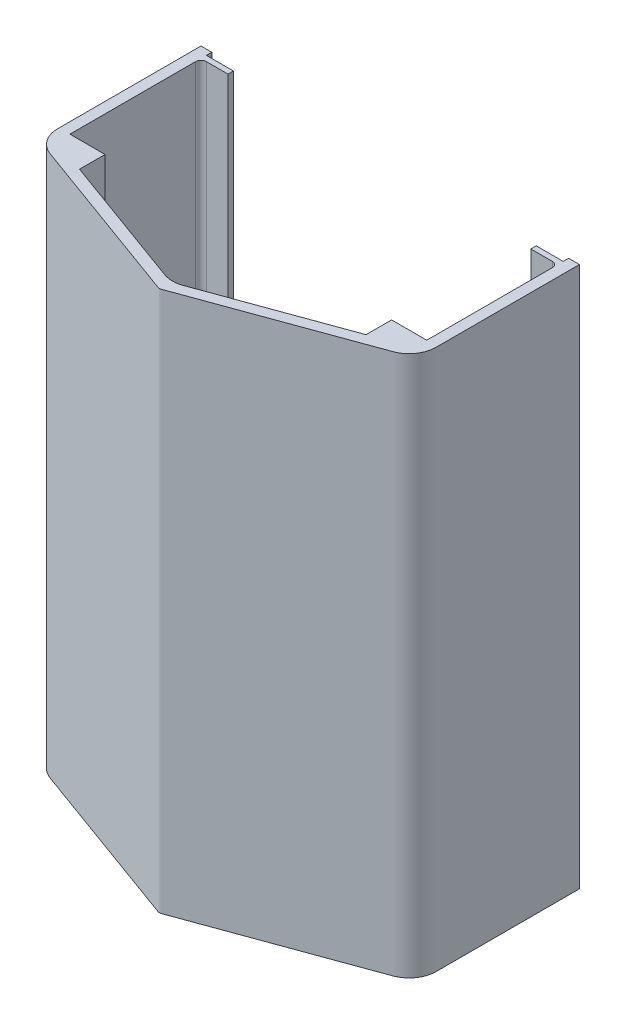
from build123d import *

# Parameters (mm, degrees)
SHELL1_T            = -4
FILLET1_R           = 10
BOSS_EXTRUDE4_DEPTH = 200
CUT_EXTRUDE1_DEPTH  = 200
FILLET3_R           = 2


with BuildPart() as part:
    # Sketch3 for Loft1 → Loft1 section 0
    with BuildSketch(Plane(origin=(0, 200, 0), x_dir=(1, 0, 0), z_dir=(0, 1, 0))):
        with BuildLine():
            Line((-91.643479102, 47.875432933), (48.356520898, 47.875432933))
            Line((48.356520898, 47.875432933), (48.356520898, -5.122491685))
            # circular arc as an exact rational Bezier (weights 1, cos(half-angle), 1)
            Bezier((48.356520898, -5.122491685), (48.356520898, -12.124567067), (41.776722331, -14.519417892), weights=[1, 0.819152044, 1])
            Line((41.776722331, -14.519417892), (-20.959438815, -37.353513162))
            Bezier((-20.959438815, -37.353513162), (-21.643479102, -37.602483465), (-22.327519388, -37.353513162), weights=[1, 0.939692621, 1])
            Line((-22.327519388, -37.353513162), (-85.063680535, -14.519417892))
            Bezier((-85.063680535, -14.519417892), (-91.643479102, -12.124567067), (-91.643479102, -5.122491685), weights=[1, 0.819152044, 1])
            Line((-91.643479102, -5.122491685), (-91.643479102, 47.875432933))
        make_face()
    # Sketch2 for Loft1 → Loft1 section 1
    with BuildSketch(Plane(origin=(0, 0, 0), x_dir=(1, 0, 0), z_dir=(0, 1, 0))):
        with BuildLine():
            Line((-91.643479102, 47.875432933), (48.356520898, 47.875432933))
            Line((48.356520898, 47.875432933), (48.356520898, -5.122491685))
            Bezier((48.356520898, -5.122491685), (48.356520898, -12.124567067), (41.776722331, -14.519417892), weights=[1, 0.819152044, 1])
            Line((41.776722331, -14.519417892), (-20.959438815, -37.353513162))
            Bezier((-20.959438815, -37.353513162), (-21.643479102, -37.602483465), (-22.327519388, -37.353513162), weights=[1, 0.939692621, 1])
            Line((-22.327519388, -37.353513162), (-85.063680535, -14.519417892))
            Bezier((-85.063680535, -14.519417892), (-91.643479102, -12.124567067), (-91.643479102, -5.122491685), weights=[1, 0.819152044, 1])
            Line((-91.643479102, -5.122491685), (-91.643479102, 47.875432933))
        make_face()
    loft()

    # Shell1
    shell1_openings = [part.faces().sort_by_distance(p)[0] for p in [
        (-21.643479102, 200, -11.173558068),
        (-21.643479102, 0, -11.173558068),
    ]]
    offset(amount=SHELL1_T, openings=shell1_openings)

    # Fillet1
    fillet1_edges = [part.edges().sort_by_distance(p)[0] for p in [
        (-21.643479102, 100, 33.345772375),
    ]]
    fillet(fillet1_edges, radius=FILLET1_R)

    # Sketch7 → Boss-Extrude4 (add)
    with BuildSketch(Plane(origin=(0, 200, 0), x_dir=(1, 0, 0), z_dir=(0, 1, 0))):
        Polygon((46.356653815, -4.610276577), (46.356653815, -9.110276577), (31.356653815, -14.569830091), (31.356653815, -4.610276577), align=None)
        Polygon((-89.643479632, -4.610276577), (-89.643479632, -9.110276577), (-74.643479632, -14.569830091), (-74.643479632, -4.610276577), align=None)
    extrude(amount=-BOSS_EXTRUDE4_DEPTH)

    # Sketch8 → Cut-Extrude1 (cut)
    with BuildSketch(Plane(origin=(0, 200, 0), x_dir=(1, 0, 0), z_dir=(0, 1, 0))):
        Polygon((-87.643479102, 47.875432933), (-77.643479102, 47.875432933), (34.356520898, 47.875432933), (44.356520898, 47.875432933), (44.356520898, 45.875432933), (34.356520898, 45.875432933), (34.356520898, 43.875432933), (-77.643479102, 43.875432933), (-77.643479102, 45.875432933), (-87.643479102, 45.875432933), align=None)
    extrude(amount=-CUT_EXTRUDE1_DEPTH, mode=Mode.SUBTRACT)

    # Fillet3
    fillet3_edges = [part.edges().sort_by_distance(p)[0] for p in [
        (44.356520898, 100, -43.875432933),
        (-87.643479102, 100, -43.875432933),
    ]]
    fillet(fillet3_edges, radius=FILLET3_R)


solid = part.part
